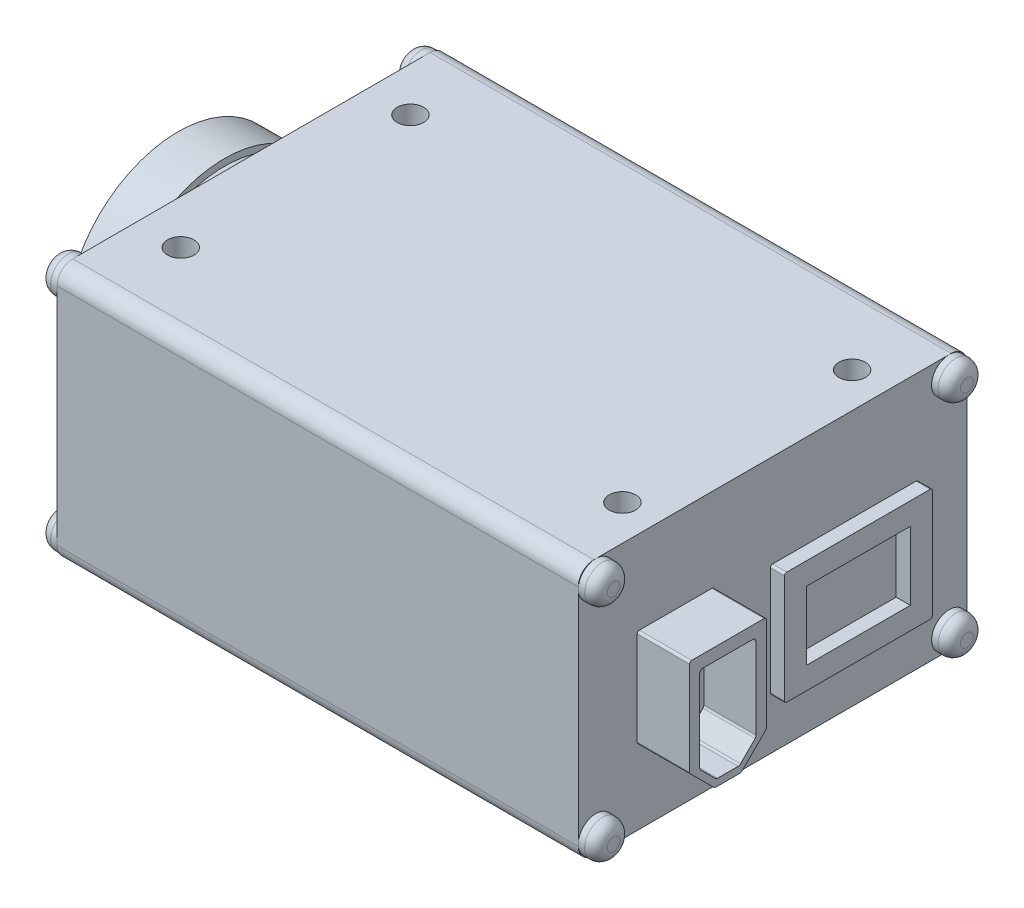
from build123d import *

# Parameters (mm, degrees)
SKETCH1_W                       = 59
SKETCH1_H                       = 44
EXTRUDE1_DEPTH                  = 14.5
SKETCH2_R                       = 12.7
SKETCH2_R_2                     = 10.922
EXTRUDE2_DEPTH                  = 8.3
SKETCH3_W                       = 3.048
SKETCH3_H                       = 0.762
FILLET3_R                       = 1.778
EXTRUDE3_DEPTH                  = 2
EXTRUDE3_DEPTH_BACK             = 61
SKETCH5_R                       = 2
FILLET1_R                       = 1.27
EXTRUDE4_DEPTH                  = 5.92
SKETCH7_W                       = 11.74
SKETCH7_H                       = 7.75
EXTRUDE5_DEPTH                  = 1.6
M3X0_5_TAPPED_HOLE1_D           = 2.5
M3X0_5_TAPPED_HOLE1_DEPTH       = 8.4836
M3X0_5_TAPPED_HOLE1_CBORE_D     = 3
M3X0_5_TAPPED_HOLE1_CBORE_DEPTH = 5.9944
M3X0_5_TAPPED_HOLE1_TIP         = 0.751075774


with BuildPart() as part:
    # Sketch1 → Extrude1 (new, symmetric)
    with BuildSketch(Plane(origin=(0, 0, 0), x_dir=(1, 0, 0), z_dir=(0, 1, 0))):
        with Locations((29.5, 0)):
            Rectangle(SKETCH1_W, SKETCH1_H)
    extrude(amount=EXTRUDE1_DEPTH, both=True)

    # Sketch2 → Extrude2 (add)
    with BuildSketch(Plane.ZY):
        with Locations(Location((0, 0, 0), (0, 0, 180))):
            Circle(SKETCH2_R)
        with Locations(Location((0, 0, 0), (0, 0, 180))):
            Circle(SKETCH2_R_2, mode=Mode.SUBTRACT)
    extrude(amount=EXTRUDE2_DEPTH)

    # Sketch3 → Cut-Revolve1 (revolve, cut)
    with BuildSketch(Plane(origin=(0, 0, 0), x_dir=(1, 0, 0), z_dir=(0, 1, 0))):
        with Locations((-1.524, 12.319)):
            Rectangle(SKETCH3_W, SKETCH3_H)
    revolve(axis=Axis((0, 0, 0), (-1, 0, 0)), mode=Mode.SUBTRACT)

    # Fillet3
    fillet3_edges = [part.edges().sort_by_distance(p)[0] for p in [
        (29.5, 14.5, -22),
        (29.5, -14.5, -22),
        (29.5, -14.5, 22),
        (29.5, 14.5, 22),
    ]]
    fillet(fillet3_edges, radius=FILLET3_R)

    # Sketch5 → Extrude3 (add, two sides: drawn at the far end of the back side and taken through both)
    with BuildSketch(Plane(origin=(59, 0, 0), x_dir=(0, 0, -1), z_dir=(1, 0, 0)).offset(-EXTRUDE3_DEPTH_BACK)):
        with Locations((-20, 12.5)):
            Circle(SKETCH5_R)
        with Locations((20, 12.5)):
            Circle(SKETCH5_R)
        with Locations((20, -12.5)):
            Circle(SKETCH5_R)
        with Locations(Location((-20, -12.5, 0), (0, 0, 180))):
            Circle(SKETCH5_R)
    extrude(amount=EXTRUDE3_DEPTH + EXTRUDE3_DEPTH_BACK)

    # Fillet1
    fillet1_edges = [part.edges().sort_by_distance(p)[0] for p in [
        (-2, 12.5, 22),
        (61, 12.5, 22),
        (-2, 12.5, -18),
        (61, 12.5, -18),
        (-2, -12.5, -18),
        (61, -12.5, -18),
        (-2, -12.5, 18),
        (61, -12.5, 18),
    ]]
    fillet(fillet1_edges, radius=FILLET1_R)

    # Sketch6 → Extrude4 (add)
    with BuildSketch(Plane(origin=(59, 0, 0), x_dir=(0, 0, -1), z_dir=(1, 0, 0))):
        with BuildLine():
            Line((-12.552737025, -8.708973683), (-15.256290416, -6.005420292))
            ThreePointArc((-15.256290416, -6.005420292), (-15.310483604, -5.924314455), (-15.32951372, -5.828643597))
            Line((-15.32951372, -5.828643597), (-15.32951372, 4.767803013))
            ThreePointArc((-15.32951372, 4.767803013), (-15.256290416, 4.944579708), (-15.07951372, 5.017803013))
            Line((-15.07951372, 5.017803013), (-6.87951372, 5.017803013))
            ThreePointArc((-6.87951372, 5.017803013), (-6.702737025, 4.944579708), (-6.62951372, 4.767803013))
            Line((-6.62951372, 4.767803013), (-6.62951372, -5.828643597))
            ThreePointArc((-6.62951372, -5.828643597), (-6.648543837, -5.924314455), (-6.702737025, -6.005420292))
            Line((-6.702737025, -6.005420292), (-9.406290416, -8.708973683))
            ThreePointArc((-9.406290416, -8.708973683), (-9.487396253, -8.76316687), (-9.583067111, -8.782196987))
            Line((-9.583067111, -8.782196987), (-9.822649185, -8.782196987))
            Line((-9.822649185, -8.782196987), (-12.129470259, -8.782196987))
            Line((-12.129470259, -8.782196987), (-12.37596033, -8.782196987))
            ThreePointArc((-12.37596033, -8.782196987), (-12.471631188, -8.76316687), (-12.552737025, -8.708973683))
        make_face()
        with BuildLine():
            Line((-14.058902435, -6.23366885), (-12.412312972, -7.880258313))
            ThreePointArc((-12.412312972, -7.880258313), (-12.282543632, -7.966967413), (-12.129470259, -7.9974156))
            Line((-12.129470259, -7.9974156), (-9.822649185, -7.9974156))
            ThreePointArc((-9.822649185, -7.9974156), (-9.669575812, -7.966967413), (-9.539806473, -7.880258313))
            Line((-9.539806473, -7.880258313), (-7.89321701, -6.23366885))
            ThreePointArc((-7.89321701, -6.23366885), (-7.806507909, -6.103899511), (-7.776059722, -5.950826138))
            Line((-7.776059722, -5.950826138), (-7.776059722, 3.217803013))
            ThreePointArc((-7.776059722, 3.217803013), (-7.89321701, 3.500645725), (-8.176059722, 3.617803013))
            Line((-8.176059722, 3.617803013), (-13.776059722, 3.617803013))
            ThreePointArc((-13.776059722, 3.617803013), (-14.058902435, 3.500645725), (-14.176059722, 3.217803013))
            Line((-14.176059722, 3.217803013), (-14.176059722, -5.950826138))
            ThreePointArc((-14.176059722, -5.950826138), (-14.145611535, -6.103899511), (-14.058902435, -6.23366885))
        make_face(mode=Mode.SUBTRACT)
    extrude(amount=EXTRUDE4_DEPTH)

    # Sketch7 → Extrude5 (add)
    with BuildSketch(Plane(origin=(59, 0, 0), x_dir=(0, 0, -1), z_dir=(1, 0, 0))):
        with BuildLine():
            Line((-0.00021372, 3.967803013), (16.23978628, 3.967803013))
            ThreePointArc((16.23978628, 3.967803013), (16.416562975, 3.894579708), (16.48978628, 3.717803013))
            Line((16.48978628, 3.717803013), (16.48978628, -8.532196987))
            ThreePointArc((16.48978628, -8.532196987), (16.416562975, -8.708973683), (16.23978628, -8.782196987))
            Line((16.23978628, -8.782196987), (-0.00021372, -8.782196987))
            ThreePointArc((-0.00021372, -8.782196987), (-0.176990416, -8.708973683), (-0.25021372, -8.532196987))
            Line((-0.25021372, -8.532196987), (-0.25021372, 3.717803013))
            ThreePointArc((-0.25021372, 3.717803013), (-0.176990416, 3.894579708), (-0.00021372, 3.967803013))
        make_face()
        with Locations((8.123341158, -2.407196987)):
            Rectangle(SKETCH7_W, SKETCH7_H, mode=Mode.SUBTRACT)
    extrude(amount=EXTRUDE5_DEPTH)

    # M3x0.5 Tapped Hole1
    with Locations(Plane(origin=(0, 14.5, 0), x_dir=(-1, 0, 0), z_dir=(0, 1, 0))):
        with Locations((-55, 13), (-55, -13), (-5, -13), (-5, 13)):
            CounterBoreHole(M3X0_5_TAPPED_HOLE1_D / 2, M3X0_5_TAPPED_HOLE1_CBORE_D / 2, M3X0_5_TAPPED_HOLE1_CBORE_DEPTH, depth=M3X0_5_TAPPED_HOLE1_DEPTH)
            with Locations((0, 0, -(M3X0_5_TAPPED_HOLE1_DEPTH + M3X0_5_TAPPED_HOLE1_TIP / 2))):  # 118° drill point
                Cone(0, M3X0_5_TAPPED_HOLE1_D / 2, M3X0_5_TAPPED_HOLE1_TIP, mode=Mode.SUBTRACT)


solid = part.part
